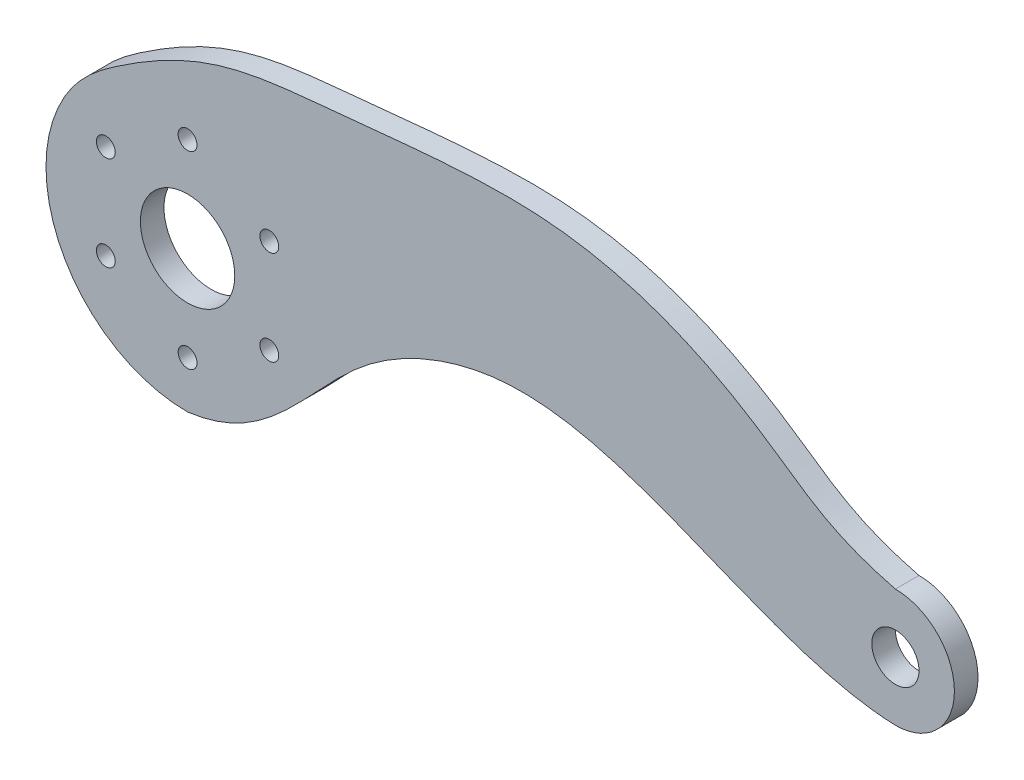
from build123d import *

# Parameters (mm, degrees)
SKETCH1_R           = 5
SKETCH1_R_2         = 10
BOSS_EXTRUDE3_DEPTH = 5


with BuildPart() as part:
    # Sketch1 → Boss-Extrude3 (new body)
    # profile 1 of 2: a face of its own
    with BuildSketch(Plane.XY):
        with BuildLine():
            add(Edge.make_bspline(
                [(-26.063461661, 14.855839466), (-22.995207495, 20.238862419), (-18.617864266, 23.494747377), (-14.633714845, 26.188821849)],
                knots=[0, 0, 0, 0, 0.056043779, 0.056043779, 0.056043779, 0.056043779], degree=3))
            ThreePointArc((-26.063461661, 14.855839466), (-25.939113169, -15.071907909), (0, -30))
            add(Edge.make_bspline(
                [(0, -30), (17.93675339, -27.745895163), (30.170167076, -2.352031791), (85.215870065, 19.611994815), (122.19936238, -11.53423425), (150, -12.5)],
                knots=[0, 0, 0, 0, 0.288188908, 0.475939829, 1, 1, 1, 1], degree=3))
            ThreePointArc((150, -12.5), (154.015063849, -11.837620635), (157.604608427, -9.920681966))
            add(Edge.make_bspline(
                [(157.604608427, -9.920681966), (158.523147842, -9.170588579), (159.428456142, -8.206961361)],
                knots=[0.991193685, 0.991193685, 0.991193685, 1, 1, 1], degree=2))
            ThreePointArc((159.428456142, -8.206961361), (162.5, 0), (159.428456142, 8.206961361))
            ThreePointArc((159.428456142, 8.206961361), (159.074763389, 8.59643353), (158.704995258, 8.970677653))
            ThreePointArc((158.704995258, 8.970677653), (154.696622688, 11.584115647), (150, 12.5))
            add(Edge.make_bspline(
                [(-14.633714845, 26.188821849), (4.471910737, 39.10801054), (20.159751535, 39.107737434), (86.741615763, 46.999815307), (125.812924925, 25.830072722), (135.882657692, 16.075482759), (150, 12.5)],
                knots=[0.056043779, 0.056043779, 0.056043779, 0.056043779, 0.324796613, 0.474987684, 0.725167046, 0.945335071, 0.945335071, 0.945335071, 0.945335071], degree=3))
        make_face()
        with BuildLine():
            ThreePointArc((18.232654753, 8.220115611), (19.553172314, 4.203980551), (20, 0))
            ThreePointArc((20, 0), (19.553172314, -4.203980551), (18.232654753, -8.220115611))
            ThreePointArc((18.232654753, -8.220115611), (19.027009373, -8.956997928), (19.320508076, -10))
            ThreePointArc((19.320508076, -10), (18.276880515, -11.756516939), (16.235156318, -11.679884389))
            ThreePointArc((16.235156318, -11.679884389), (10, -17.320508076), (1.997498436, -19.9))
            ThreePointArc((1.997498436, -19.9), (1.999374511, -19.949984358), (2, -20))
            ThreePointArc((2, -20), (-0.050015642, -21.999374511), (-1.997498436, -19.9))
            ThreePointArc((-1.997498436, -19.9), (-10, -17.320508076), (-16.235156318, -11.679884389))
            ThreePointArc((-16.235156318, -11.679884389), (-19.052558883, -11), (-18.232654753, -8.220115611))
            ThreePointArc((-18.232654753, -8.220115611), (-20, 0), (-18.232654753, 8.220115611))
            ThreePointArc((-18.232654753, 8.220115611), (-19.052558883, 11), (-16.235156318, 11.679884389))
            ThreePointArc((-16.235156318, 11.679884389), (-10, 17.320508076), (-1.997498436, 19.9))
            ThreePointArc((-1.997498436, 19.9), (-0.050015642, 21.999374511), (2, 20))
            ThreePointArc((2, 20), (1.999374511, 19.949984358), (1.997498436, 19.9))
            ThreePointArc((1.997498436, 19.9), (10, 17.320508076), (16.235156318, 11.679884389))
            ThreePointArc((16.235156318, 11.679884389), (18.276880515, 11.756516939), (19.320508076, 10))
            ThreePointArc((19.320508076, 10), (19.027009373, 8.956997928), (18.232654753, 8.220115611))
        make_face(mode=Mode.SUBTRACT)
        with Locations((150, 0)):
            Circle(SKETCH1_R, mode=Mode.SUBTRACT)
    # profile 2 of 2: a face of its own
    with BuildSketch(Plane.XY):
        with BuildLine():
            ThreePointArc((18.232654753, -8.220115611), (19.553172314, -4.203980551), (20, 0))
            ThreePointArc((20, 0), (19.553172314, 4.203980551), (18.232654753, 8.220115611))
            ThreePointArc((18.232654753, 8.220115611), (15.588457268, 9), (16.235156318, 11.679884389))
            ThreePointArc((16.235156318, 11.679884389), (10, 17.320508076), (1.997498436, 19.9))
            ThreePointArc((1.997498436, 19.9), (0, 18), (-1.997498436, 19.9))
            ThreePointArc((-1.997498436, 19.9), (-10, 17.320508076), (-16.235156318, 11.679884389))
            ThreePointArc((-16.235156318, 11.679884389), (-15.563991136, 10.956372439), (-15.320508076, 10))
            ThreePointArc((-15.320508076, 10), (-16.277506003, 8.293498703), (-18.232654753, 8.220115611))
            ThreePointArc((-18.232654753, 8.220115611), (-20, 0), (-18.232654753, -8.220115611))
            ThreePointArc((-18.232654753, -8.220115611), (-16.277506003, -8.293498703), (-15.320508076, -10))
            ThreePointArc((-15.320508076, -10), (-15.563991136, -10.956372439), (-16.235156318, -11.679884389))
            ThreePointArc((-16.235156318, -11.679884389), (-10, -17.320508076), (-1.997498436, -19.9))
            ThreePointArc((-1.997498436, -19.9), (0, -18), (1.997498436, -19.9))
            ThreePointArc((1.997498436, -19.9), (10, -17.320508076), (16.235156318, -11.679884389))
            ThreePointArc((16.235156318, -11.679884389), (15.588457268, -9), (18.232654753, -8.220115611))
        make_face()
        Circle(SKETCH1_R_2, mode=Mode.SUBTRACT)
    extrude(amount=BOSS_EXTRUDE3_DEPTH)


solid = part.part
